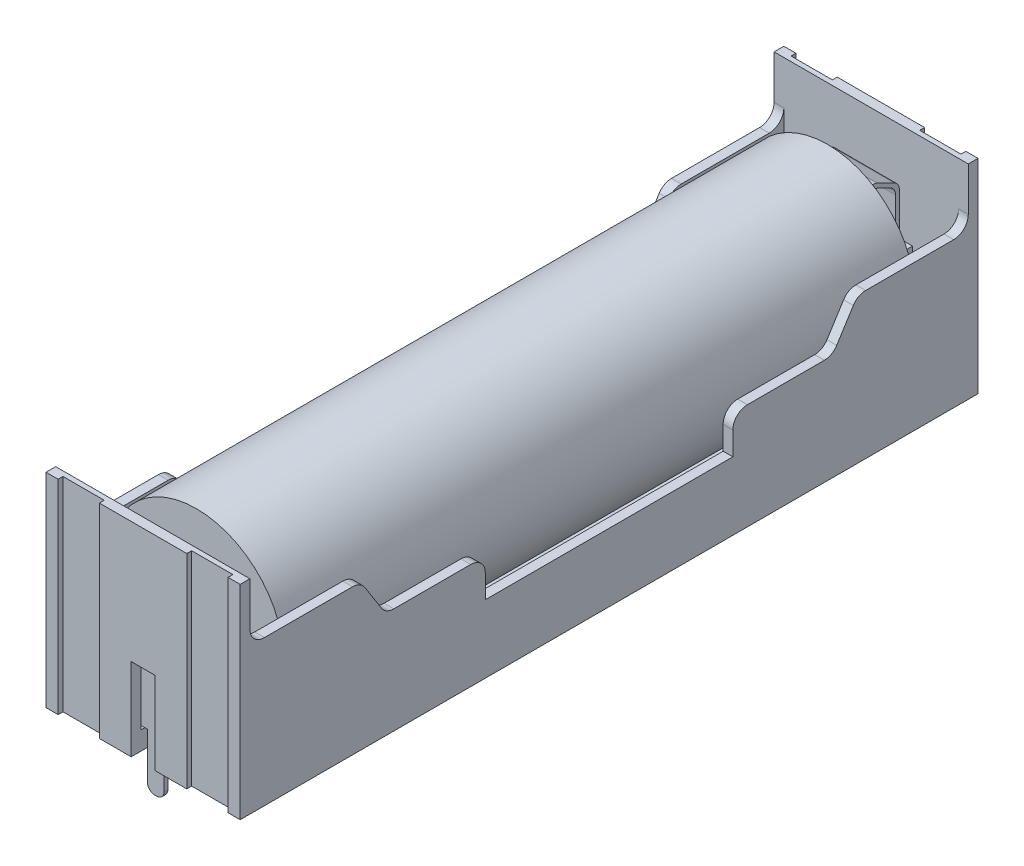
from build123d import *

# Parameters (mm, degrees)
SKETCH_1_W                  = 20
SKETCH_1_H                  = 76
EXTRUDE_780_DEPTH           = 21
CUT_EXTRUDE_1895_DEPTH      = 45.55333882
SKETCH_3_W                  = 18
SKETCH_3_H                  = 74
CUT_EXTRUDE_2456_DEPTH      = 19.1
CUT_EXTRUDE_2748_DEPTH      = 15
CUT_EXTRUDE_2748_DEPTH_BACK = 15
SKETCH_4_W                  = 74
SKETCH_4_H                  = 12
CUT_EXTRUDE_3347_DEPTH      = 15
FILLET_2_R                  = 1.5
FILLET_2_OF_MIRROR_2_R      = 1.5
SKETCH_6_W                  = 2.45
SKETCH_6_H                  = 7
CUT_EXTRUDE_4471_DEPTH      = 8.5
SKETCH_11_R                 = 1.5
CUT_EXTRUDE_4812_DEPTH      = 45.55333882
EXTRUDE_START               = -0.3
SKETCH_12_R                 = 2.8
SKETCH_12_R_2               = 1.5
EXTRUDE_5233_DEPTH          = 0.3
CUT_EXTRUDE_START           = -0.5
SKETCH_13_R                 = 2.5
SKETCH_13_R_2               = 1.5
CUT_EXTRUDE_17_DEPTH        = 0.5
SKETCH_14_R                 = 1.5
SKETCH_14_W                 = 0.25
SKETCH_14_H                 = 2.6
CUT_EXTRUDE_8132_DEPTH      = 0.1
EXTRUDE_9544_DEPTH          = 8.9
EXTRUDE_10391_DEPTH         = 3.2
SKETCH_17_W                 = 1.7
SKETCH_17_H                 = 0.4
EXTRUDE_10843_DEPTH         = 5.5
FILLET_3_R                  = 1
FILLET_4_R                  = 0.75
SKETCH_18_R                 = 9
EXTRUDE_1_DEPTH             = 32.5


with BuildPart() as part:
    # Эскиз1 → Extrude 780 (new body)
    with BuildSketch(Plane(origin=(0, 0, 0), x_dir=(1, 0, 0), z_dir=(0, 1, 0))):
        Rectangle(SKETCH_1_W, SKETCH_1_H)
    extrude(amount=EXTRUDE_780_DEPTH)

    # Эскиз2 → Cut-Extrude 1895 (cut, through all)
    with BuildSketch(Plane(origin=(0, 0, 0), x_dir=(1, 0, 0), z_dir=(0, 1, 0))):
        Polygon((-4.5, 37.5), (-4.5, 38), (4.5, 38), (4.5, 37.5), (8.75, 37.5), (8.75, 38), (10, 38), (10, 46.507054696), (-10, 46.507054696), (-10, 38), (-8.75, 38), (-8.75, 37.5), align=None)
    cut_extrude_1895 = extrude(amount=CUT_EXTRUDE_1895_DEPTH, mode=Mode.SUBTRACT)

    # Зеркальное отражение1: Cut-Extrude 1895 across plane
    add(cut_extrude_1895.mirror(Plane.XY), mode=Mode.SUBTRACT)

    # Эскиз3 → Cut-Extrude 2456 (cut)
    with BuildSketch(Plane(origin=(0, 21, 0), x_dir=(1, 0, 0), z_dir=(0, 1, 0))):
        Rectangle(SKETCH_3_W, SKETCH_3_H)
    extrude(amount=-CUT_EXTRUDE_2456_DEPTH, mode=Mode.SUBTRACT)

    # Эскиз4 → Cut-Extrude 2748 (cut, two sides: drawn at the far end of the back side and taken through both)
    with BuildSketch(Plane(origin=(0, 0, 0), x_dir=(0, 0, -1), z_dir=(1, 0, 0)).offset(-CUT_EXTRUDE_2748_DEPTH_BACK)):
        with Locations((0, 21)):
            Rectangle(SKETCH_4_W, SKETCH_4_H)
    extrude(amount=CUT_EXTRUDE_2748_DEPTH + CUT_EXTRUDE_2748_DEPTH_BACK, mode=Mode.SUBTRACT)

    # Эскиз5 → Cut-Extrude 3347 (cut)
    with BuildSketch(Plane(origin=(10, 0, 0), x_dir=(0, 0, -1), z_dir=(1, 0, 0))):
        Polygon((35.6, 21), (-35.6, 21), (-35.6, 15), (-25.6, 15), (-23, 10.9), (-12.75, 10.9), (-12.75, 7), (12.75, 7), (12.75, 10.9), (23, 10.9), (25.6, 15), (35.6, 15), align=None)
    cut_extrude_3347 = extrude(amount=-CUT_EXTRUDE_3347_DEPTH, mode=Mode.SUBTRACT)

    # Скругление2
    fillet_2_edges = [part.edges().sort_by_distance(p)[0] for p in [
        (9.5, 10.9, -23),
        (9.5, 10.9, -12.75),
        (9.5, 10.9, 12.75),
        (9.5, 10.9, 23),
        (9.5, 15, -37),
        (9.5, 15, -25.6),
        (9.5, 15, 37),
        (9.5, 15, 25.6),
    ]]
    fillet(fillet_2_edges, radius=FILLET_2_R)

    # Зеркальное отражение2: Cut-Extrude 3347 across plane
    add(cut_extrude_3347.mirror(Plane(origin=(0, 0, 0), x_dir=(0, 0, 1), z_dir=(1, 0, 0))), mode=Mode.SUBTRACT)

    # Скругление2 of Зеркальное отражение2
    fillet_2_of_mirror_2_edges = [part.edges().sort_by_distance(p)[0] for p in [
        (-9.5, 10.9, -23),
        (-9.5, 10.9, -12.75),
        (-9.5, 10.9, 12.75),
        (-9.5, 10.9, 23),
        (-9.5, 15, -37),
        (-9.5, 15, -25.6),
        (-9.5, 15, 37),
        (-9.5, 15, 25.6),
    ]]
    fillet(fillet_2_of_mirror_2_edges, radius=FILLET_2_OF_MIRROR_2_R)

    # Эскиз6 → Cut-Extrude 4471 (cut)
    with BuildSketch(Plane(origin=(0, 0, 0), x_dir=(1, 0, 0), z_dir=(0, 1, 0))):
        with Locations((0, -38)):
            Rectangle(SKETCH_6_W, SKETCH_6_H)
        with Locations((0, 38)):
            Rectangle(SKETCH_6_W, SKETCH_6_H)
    extrude(amount=CUT_EXTRUDE_4471_DEPTH, mode=Mode.SUBTRACT)

    # Эскиз11 → Cut-Extrude 4812 (cut, through all)
    with BuildSketch(Plane(origin=(0, 0, 0), x_dir=(1, 0, 0), z_dir=(0, 1, 0))):
        with Locations((0, 27.5)):
            Circle(SKETCH_11_R)
        with Locations((0, -27.5)):
            Circle(SKETCH_11_R)
    extrude(amount=CUT_EXTRUDE_4812_DEPTH, mode=Mode.SUBTRACT)

    # Эскиз12 → Extrude 5233 (add)
    # profile 1 of 2: a face of its own
    with BuildSketch(Plane(origin=(0, 0, 0), x_dir=(1, 0, 0), z_dir=(0, 1, 0)).offset(EXTRUDE_START)):
        with Locations((0, 27.5)):
            Circle(SKETCH_12_R)
        with Locations((0, 27.5)):
            Circle(SKETCH_12_R_2, mode=Mode.SUBTRACT)
    # profile 2 of 2: a face of its own
    with BuildSketch(Plane(origin=(0, 0, 0), x_dir=(1, 0, 0), z_dir=(0, 1, 0)).offset(EXTRUDE_START)):
        with Locations((0, -27.5)):
            Circle(SKETCH_12_R)
        with Locations((0, -27.5)):
            Circle(SKETCH_12_R_2, mode=Mode.SUBTRACT)
    extrude(amount=EXTRUDE_5233_DEPTH)

    # Эскиз13 → Вырез-Вытянуть17 (cut)
    # profile 1 of 2: a face of its own
    with BuildSketch(Plane(origin=(0, 1.9, 0), x_dir=(1, 0, 0), z_dir=(0, 1, 0)).offset(CUT_EXTRUDE_START)):
        with Locations((0, -27.5)):
            Circle(SKETCH_13_R)
        with Locations((0, -27.5)):
            Circle(SKETCH_13_R_2, mode=Mode.SUBTRACT)
    # profile 2 of 2: a face of its own
    with BuildSketch(Plane(origin=(0, 1.9, 0), x_dir=(1, 0, 0), z_dir=(0, 1, 0)).offset(CUT_EXTRUDE_START)):
        with Locations((0, 27.5)):
            Circle(SKETCH_13_R)
        with Locations((0, 27.5)):
            Circle(SKETCH_13_R_2, mode=Mode.SUBTRACT)
    extrude(amount=CUT_EXTRUDE_17_DEPTH, mode=Mode.SUBTRACT)

    # Эскиз14 → Cut-Extrude 8132 (cut)
    # profile 1 of 2: a face of its own
    with BuildSketch(Plane(origin=(0, 1.9, 0), x_dir=(1, 0, 0), z_dir=(0, 1, 0))):
        with Locations((0, 20.5)):
            Circle(SKETCH_14_R)
        Polygon((-0.125, 21.8), (0.125, 21.8), (0.125, 20.625), (1.3, 20.625), (1.3, 20.375), (0.125, 20.375), (0.125, 19.2), (-0.125, 19.2), (-0.125, 20.375), (-1.3, 20.375), (-1.3, 20.625), (-0.125, 20.625), align=None, mode=Mode.SUBTRACT)
    # profile 2 of 2: a face of its own
    with BuildSketch(Plane(origin=(0, 1.9, 0), x_dir=(1, 0, 0), z_dir=(0, 1, 0))):
        with Locations((0, -20.5)):
            Circle(SKETCH_14_R)
        with Locations((0, -20.5)):
            Rectangle(SKETCH_14_W, SKETCH_14_H, mode=Mode.SUBTRACT)
    extrude(amount=-CUT_EXTRUDE_8132_DEPTH, mode=Mode.SUBTRACT)

    # Эскиз15 → Extrude 9544 (add)
    with BuildSketch(Plane(origin=(0, 1.9, 0), x_dir=(1, 0, 0), z_dir=(0, 1, 0))):
        Polygon((-2.25, 35), (-4.25, 35), (-4.25, 37), (-3.25, 37), (-3.25, 36), (-2.25, 36), align=None)
        Polygon((2.25, 35), (2.25, 36), (3.25, 36), (3.25, 37), (4.25, 37), (4.25, 35), align=None)
        Polygon((4.25, -35), (2.25, -35), (2.25, -36), (3.25, -36), (3.25, -37), (4.25, -37), align=None)
        Polygon((-2.25, -36), (-2.25, -35), (-4.25, -35), (-4.25, -37), (-3.25, -37), (-3.25, -36), align=None)
    extrude(amount=EXTRUDE_9544_DEPTH)


with BuildPart() as body_2:
    # Эскиз16 → Extrude 10391 (new, symmetric)
    with BuildSketch(Plane.ZY):
        Polygon((-36.3, 2), (-36.3, 15.826972516), (-33.848539634, 17.01426896), (-30.994965619, 13.823876222), (-30.699555061, 9.402575836), (-30.300444939, 9.429242503), (-30.605034381, 13.987919845), (-33.751460366, 17.50573104), (-36.7, 16.077688118), (-36.7, 2), align=None)
    extrude(amount=EXTRUDE_10391_DEPTH, both=True)

    # Эскиз17 → Extrude 10843 (add)
    with BuildSketch(Plane.XZ.offset(-2)):
        with Locations((0, -36.5)):
            Rectangle(SKETCH_17_W, SKETCH_17_H)
    extrude(amount=EXTRUDE_10843_DEPTH)

    # Скругление3
    fillet_3_edges = [body_2.edges().sort_by_distance(p)[0] for p in [
        (0, 13.823876222, -30.994965619),
        (0, 13.987919845, -30.605034381),
        (0, 17.01426896, -33.848539634),
        (0, 17.50573104, -33.751460366),
        (0, 15.826972516, -36.3),
        (0, 16.077688118, -36.7),
    ]]
    fillet(fillet_3_edges, radius=FILLET_3_R)

    # Скругление4
    fillet_4_edges = [body_2.edges().sort_by_distance(p)[0] for p in [
        (3.2, 2, -36.5),
        (0.85, -3.5, -36.5),
        (-0.85, -3.5, -36.5),
        (-3.2, 2, -36.5),
        (3.2, 9.41590917, -30.5),
        (-3.2, 9.41590917, -30.5),
    ]]
    fillet(fillet_4_edges, radius=FILLET_4_R)


with BuildPart() as body_3:
    # Mirror1: mirrored copy
    add(body_2.part.mirror(Plane.XY))


with BuildPart() as body_2_1:
    add(body_2.part)

    add(body_3.part)  # Бобышка-Вытянуть1 merges body 3
    # Эскиз18 → Бобышка-Вытянуть1 (add, symmetric)
    with BuildSketch(Plane.XY):
        with Locations((0, 11)):
            Circle(SKETCH_18_R)
    extrude(amount=EXTRUDE_1_DEPTH, both=True)


solid = Compound([part.part, body_2_1.part])
